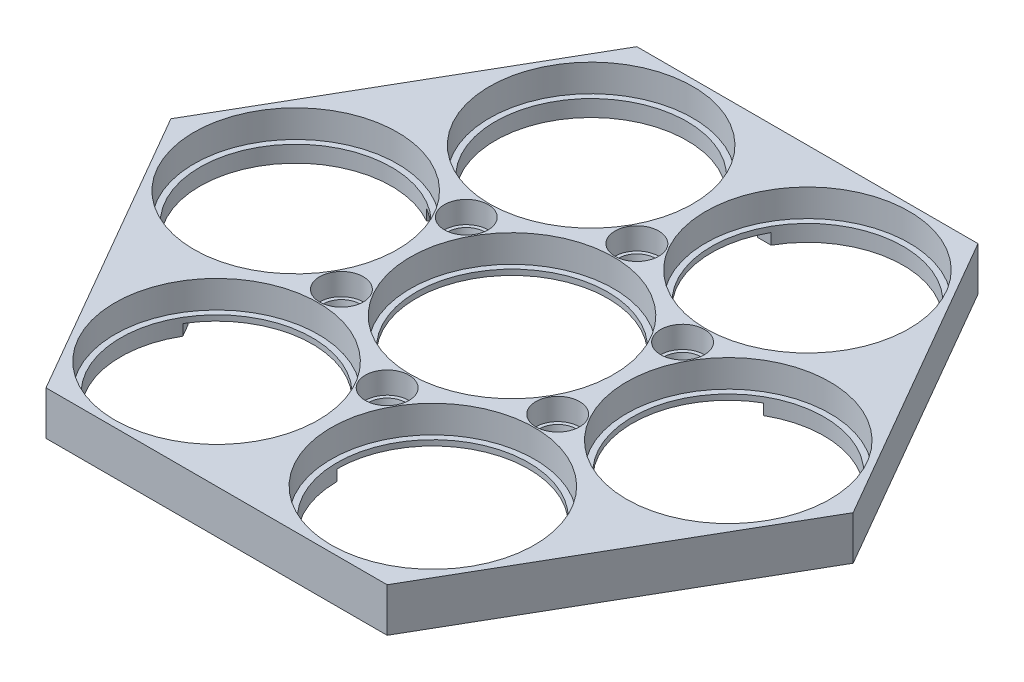
from build123d import *

# Parameters (mm, degrees)
SKETCH1_R                    = 17.5
BOSS_EXTRUDE1_DEPTH          = 1
SKETCH2_R                    = 18.575
BOSS_EXTRUDE2_DEPTH          = 5
CUT_EXTRUDE1_DEPTH           = 83.640310894
CUT_EXTRUDE1_DEPTH_BACK      = 4
SKETCH3_R                    = 4
SKETCH3_2_R                  = 4
CUT_EXTRUDE2_DEPTH           = 83.640310894
CUT_EXTRUDE2_DRAFT           = -9
CUT_EXTRUDE2_PROFILE_2_DEPTH = 83.640310894
CUT_EXTRUDE2_PROFILE_2_DRAFT = -9
CUT_EXTRUDE2_PROFILE_3_DEPTH = 83.640310894
CUT_EXTRUDE2_PROFILE_3_DRAFT = -9
CUT_EXTRUDE2_PROFILE_4_DEPTH = 83.640310894
CUT_EXTRUDE2_PROFILE_4_DRAFT = -9
CUT_EXTRUDE2_PROFILE_5_DEPTH = 83.640310894
CUT_EXTRUDE2_PROFILE_5_DRAFT = -9
CUT_EXTRUDE2_PROFILE_6_DEPTH = 83.640310894
CUT_EXTRUDE2_PROFILE_6_DRAFT = -9
BOSS_EXTRUDE3_START          = 2
BOSS_EXTRUDE3_DEPTH          = 2
CUT_EXTRUDE5_DEPTH           = 2


with BuildPart() as part:
    # Sketch1 → Boss-Extrude1 (new body)
    with BuildSketch(Plane(origin=(0, 0, 0), x_dir=(1, 0, 0), z_dir=(0, 1, 0))):
        Polygon((-31.152667816, -53.958003449), (31.152667816, -53.958003449), (62.305335633, 0), (31.152667816, 53.958003449), (-31.152667816, 53.958003449), (-62.305335633, 0), align=None)
        with Locations(Location((-39.5, 0, 0), (0, 0, 270))):
            Circle(SKETCH1_R, mode=Mode.SUBTRACT)
        with Locations(Location((-19.75, -34.208003449, 0), (0, 0, 270))):
            Circle(SKETCH1_R, mode=Mode.SUBTRACT)
        with Locations(Location((19.75, -34.208003449, 0), (0, 0, 270))):
            Circle(SKETCH1_R, mode=Mode.SUBTRACT)
        with Locations(Location((39.5, 0, 0), (0, 0, 270))):
            Circle(SKETCH1_R, mode=Mode.SUBTRACT)
        with Locations(Location((19.75, 34.208003449, 0), (0, 0, 270))):
            Circle(SKETCH1_R, mode=Mode.SUBTRACT)
        with Locations(Location((-19.75, 34.208003449, 0), (0, 0, 270))):
            Circle(SKETCH1_R, mode=Mode.SUBTRACT)
        with Locations(Location((0, 0, 0), (0, 0, 270))):
            Circle(SKETCH1_R, mode=Mode.SUBTRACT)
    extrude(amount=BOSS_EXTRUDE1_DEPTH)

    # Sketch2 → Boss-Extrude2 (add)
    with BuildSketch(Plane(origin=(0, 1, 0), x_dir=(1, 0, 0), z_dir=(0, 1, 0))):
        Polygon((62.305335633, 0), (31.152667816, 53.958003449), (-31.152667816, 53.958003449), (-62.305335633, 0), (-31.152667816, -53.958003449), (31.152667816, -53.958003449), align=None)
        with Locations(Location((-39.5, 0, 0), (0, 0, 270))):
            Circle(SKETCH2_R, mode=Mode.SUBTRACT)
        with Locations(Location((-19.75, 34.208003449, 0), (0, 0, 270))):
            Circle(SKETCH2_R, mode=Mode.SUBTRACT)
        with Locations(Location((19.75, 34.208003449, 0), (0, 0, 270))):
            Circle(SKETCH2_R, mode=Mode.SUBTRACT)
        with Locations(Location((0, 0, 0), (0, 0, 270))):
            Circle(SKETCH2_R, mode=Mode.SUBTRACT)
        with Locations(Location((39.5, 0, 0), (0, 0, 270))):
            Circle(SKETCH2_R, mode=Mode.SUBTRACT)
        with Locations(Location((19.75, -34.208003449, 0), (0, 0, 270))):
            Circle(SKETCH2_R, mode=Mode.SUBTRACT)
        with Locations(Location((-19.75, -34.208003449, 0), (0, 0, 270))):
            Circle(SKETCH2_R, mode=Mode.SUBTRACT)
    extrude(amount=BOSS_EXTRUDE2_DEPTH)

    # Sketch3 → Cut-Extrude1 (cut, two sides: drawn at the far end of the back side and taken through both)
    with BuildSketch(Plane(origin=(0, 6, 0), x_dir=(1, 0, 0), z_dir=(0, 1, 0)).offset(-CUT_EXTRUDE1_DEPTH_BACK)):
        with Locations(Location((-19.75, 11.402667816, 0), (0, 0, 90))):
            Circle(SKETCH3_R)
        with Locations(Location((19.75, 11.402667816, 0), (0, 0, 90))):
            Circle(SKETCH3_R)
        with Locations(Location((0, -22.805335633, 0), (0, 0, 90))):
            Circle(SKETCH3_R)
        with Locations(Location((-19.75, -11.402667816, 0), (0, 0, 90))):
            Circle(SKETCH3_R)
        with Locations(Location((19.75, -11.402667816, 0), (0, 0, 90))):
            Circle(SKETCH3_R)
        with Locations(Location((0, 22.805335633, 0), (0, 0, 90))):
            Circle(SKETCH3_R)
    extrude(amount=CUT_EXTRUDE1_DEPTH + CUT_EXTRUDE1_DEPTH_BACK, mode=Mode.SUBTRACT)


with BuildPart() as cut_extrude2_tool:
    # Sketch3<2> → Cut-Extrude2 (with draft: the straight prism first)
    with BuildSketch(Plane(origin=(0, 6, 0), x_dir=(1, 0, 0), z_dir=(0, 1, 0))):
        with Locations(Location((-19.75, 11.402667816, 0), (0, 0, 90))):
            Circle(SKETCH3_2_R)
    extrude(amount=-CUT_EXTRUDE2_DEPTH)
    # Cut-Extrude2: the draft: its side faces are tilted about the plane it starts from
    cut_extrude2_sides = [cut_extrude2_tool.faces().sort_by_distance(p)[0] for p in [
        (-19.75, -35.820155447, -7.402667816),
    ]]
    draft(cut_extrude2_sides, Plane(origin=(0, 6, 0), x_dir=(1, 0, 0), z_dir=(0, 1, 0)), CUT_EXTRUDE2_DRAFT)


with BuildPart() as part_1:
    add(part.part)

    # Cut-Extrude2: cut by cut_extrude2_tool
    add(cut_extrude2_tool.part, mode=Mode.SUBTRACT)


with BuildPart() as cut_extrude2_profile_2_tool:
    # Sketch3<2> → Cut-Extrude2 profile 2 (with draft: the straight prism first)
    with BuildSketch(Plane(origin=(0, 6, 0), x_dir=(1, 0, 0), z_dir=(0, 1, 0))):
        with Locations(Location((19.75, 11.402667816, 0), (0, 0, 90))):
            Circle(SKETCH3_2_R)
    extrude(amount=-CUT_EXTRUDE2_PROFILE_2_DEPTH)
    # Cut-Extrude2 profile 2: the draft: its side faces are tilted about the plane it starts from
    cut_extrude2_profile_2_sides = [cut_extrude2_profile_2_tool.faces().sort_by_distance(p)[0] for p in [
        (19.75, -35.820155447, -7.402667816),
    ]]
    draft(cut_extrude2_profile_2_sides, Plane(origin=(0, 6, 0), x_dir=(1, 0, 0), z_dir=(0, 1, 0)), CUT_EXTRUDE2_PROFILE_2_DRAFT)


with BuildPart() as part_2:
    add(part_1.part)

    # Cut-Extrude2 profile 2: cut by cut_extrude2_profile_2_tool
    add(cut_extrude2_profile_2_tool.part, mode=Mode.SUBTRACT)


with BuildPart() as cut_extrude2_profile_3_tool:
    # Sketch3<2> → Cut-Extrude2 profile 3 (with draft: the straight prism first)
    with BuildSketch(Plane(origin=(0, 6, 0), x_dir=(1, 0, 0), z_dir=(0, 1, 0))):
        with Locations(Location((0, -22.805335633, 0), (0, 0, 90))):
            Circle(SKETCH3_2_R)
    extrude(amount=-CUT_EXTRUDE2_PROFILE_3_DEPTH)
    # Cut-Extrude2 profile 3: the draft: its side faces are tilted about the plane it starts from
    cut_extrude2_profile_3_sides = [cut_extrude2_profile_3_tool.faces().sort_by_distance(p)[0] for p in [
        (0, -35.820155447, 26.805335633),
    ]]
    draft(cut_extrude2_profile_3_sides, Plane(origin=(0, 6, 0), x_dir=(1, 0, 0), z_dir=(0, 1, 0)), CUT_EXTRUDE2_PROFILE_3_DRAFT)


with BuildPart() as part_3:
    add(part_2.part)

    # Cut-Extrude2 profile 3: cut by cut_extrude2_profile_3_tool
    add(cut_extrude2_profile_3_tool.part, mode=Mode.SUBTRACT)


with BuildPart() as cut_extrude2_profile_4_tool:
    # Sketch3<2> → Cut-Extrude2 profile 4 (with draft: the straight prism first)
    with BuildSketch(Plane(origin=(0, 6, 0), x_dir=(1, 0, 0), z_dir=(0, 1, 0))):
        with Locations(Location((-19.75, -11.402667816, 0), (0, 0, 90))):
            Circle(SKETCH3_2_R)
    extrude(amount=-CUT_EXTRUDE2_PROFILE_4_DEPTH)
    # Cut-Extrude2 profile 4: the draft: its side faces are tilted about the plane it starts from
    cut_extrude2_profile_4_sides = [cut_extrude2_profile_4_tool.faces().sort_by_distance(p)[0] for p in [
        (-19.75, -35.820155447, 15.402667816),
    ]]
    draft(cut_extrude2_profile_4_sides, Plane(origin=(0, 6, 0), x_dir=(1, 0, 0), z_dir=(0, 1, 0)), CUT_EXTRUDE2_PROFILE_4_DRAFT)


with BuildPart() as part_4:
    add(part_3.part)

    # Cut-Extrude2 profile 4: cut by cut_extrude2_profile_4_tool
    add(cut_extrude2_profile_4_tool.part, mode=Mode.SUBTRACT)


with BuildPart() as cut_extrude2_profile_5_tool:
    # Sketch3<2> → Cut-Extrude2 profile 5 (with draft: the straight prism first)
    with BuildSketch(Plane(origin=(0, 6, 0), x_dir=(1, 0, 0), z_dir=(0, 1, 0))):
        with Locations(Location((19.75, -11.402667816, 0), (0, 0, 90))):
            Circle(SKETCH3_2_R)
    extrude(amount=-CUT_EXTRUDE2_PROFILE_5_DEPTH)
    # Cut-Extrude2 profile 5: the draft: its side faces are tilted about the plane it starts from
    cut_extrude2_profile_5_sides = [cut_extrude2_profile_5_tool.faces().sort_by_distance(p)[0] for p in [
        (19.75, -35.820155447, 15.402667816),
    ]]
    draft(cut_extrude2_profile_5_sides, Plane(origin=(0, 6, 0), x_dir=(1, 0, 0), z_dir=(0, 1, 0)), CUT_EXTRUDE2_PROFILE_5_DRAFT)


with BuildPart() as part_5:
    add(part_4.part)

    # Cut-Extrude2 profile 5: cut by cut_extrude2_profile_5_tool
    add(cut_extrude2_profile_5_tool.part, mode=Mode.SUBTRACT)


with BuildPart() as cut_extrude2_profile_6_tool:
    # Sketch3<2> → Cut-Extrude2 profile 6 (with draft: the straight prism first)
    with BuildSketch(Plane(origin=(0, 6, 0), x_dir=(1, 0, 0), z_dir=(0, 1, 0))):
        with Locations(Location((0, 22.805335633, 0), (0, 0, 90))):
            Circle(SKETCH3_2_R)
    extrude(amount=-CUT_EXTRUDE2_PROFILE_6_DEPTH)
    # Cut-Extrude2 profile 6: the draft: its side faces are tilted about the plane it starts from
    cut_extrude2_profile_6_sides = [cut_extrude2_profile_6_tool.faces().sort_by_distance(p)[0] for p in [
        (0, -35.820155447, -18.805335633),
    ]]
    draft(cut_extrude2_profile_6_sides, Plane(origin=(0, 6, 0), x_dir=(1, 0, 0), z_dir=(0, 1, 0)), CUT_EXTRUDE2_PROFILE_6_DRAFT)


with BuildPart() as part_6:
    add(part_5.part)

    # Cut-Extrude2 profile 6: cut by cut_extrude2_profile_6_tool
    add(cut_extrude2_profile_6_tool.part, mode=Mode.SUBTRACT)

    # Sketch5 → Boss-Extrude3 (add)
    with BuildSketch(Plane.XZ.offset(BOSS_EXTRUDE3_START)):
        with BuildLine():
            Line((-31.152667816, 53.958003449), (-62.305335633, 0))
            Line((-62.305335633, 0), (-57, 0))
            ThreePointArc((-57, 0), (-51.812065653, 12.43635957), (-39.324224074, 17.499117201))
            Line((-39.324224074, 17.499117201), (-34.816792077, 25.306218432))
            ThreePointArc((-34.816792077, 25.306218432), (-24.364170491, 51.088744863), (-2.25, 34.208003449))
            Line((-2.25, 34.208003449), (2.25, 34.208003449))
            ThreePointArc((2.25, 34.208003449), (11, 49.363448016), (28.5, 49.363448016))
            Line((28.5, 49.363448016), (31.152667816, 53.958003449))
            Line((31.152667816, 53.958003449), (-31.152667816, 53.958003449))
        make_face()
        with BuildLine():
            Line((-57, 0), (-62.305335633, 0))
            Line((-62.305335633, 0), (-31.152667816, -53.958003449))
            Line((-31.152667816, -53.958003449), (31.152667816, -53.958003449))
            Line((31.152667816, -53.958003449), (28.5, -49.363448016))
            ThreePointArc((28.5, -49.363448016), (15.135829509, -51.088744863), (4.507431997, -42.805335633))
            Line((4.507431997, -42.805335633), (-4.507431997, -42.805335633))
            ThreePointArc((-4.507431997, -42.805335633), (-32.062065653, -46.644363019), (-28.5, -19.052558883))
            Line((-28.5, -19.052558883), (-30.75, -15.155444566))
            ThreePointArc((-30.75, -15.155444566), (-48.25, -15.155444566), (-57, 0))
        make_face()
        with BuildLine():
            Line((28.5, -49.363448016), (31.152667816, -53.958003449))
            Line((31.152667816, -53.958003449), (62.305335633, 0))
            Line((62.305335633, 0), (31.152667816, 53.958003449))
            Line((31.152667816, 53.958003449), (28.5, 49.363448016))
            ThreePointArc((28.5, 49.363448016), (34.905444566, 42.958003449), (37.25, 34.208003449))
            ThreePointArc((37.25, 34.208003449), (36.630741414, 29.593832958), (34.816792077, 25.306218432))
            Line((34.816792077, 25.306218432), (39.324224074, 17.499117201))
            ThreePointArc((39.324224074, 17.499117201), (51.812065653, 12.43635957), (57, 0))
            ThreePointArc((57, 0), (48.25, -15.155444566), (30.75, -15.155444566))
            Line((30.75, -15.155444566), (28.5, -19.052558883))
            ThreePointArc((28.5, -19.052558883), (34.905444566, -25.458003449), (37.25, -34.208003449))
            ThreePointArc((37.25, -34.208003449), (34.905444566, -42.958003449), (28.5, -49.363448016))
        make_face()
    extrude(amount=-BOSS_EXTRUDE3_DEPTH)

    # Sketch6 → Cut-Extrude5 (cut)
    with BuildSketch(Plane.XZ.offset(2)):
        with BuildLine():
            ThreePointArc((-2, -47.537386441), (-1, -48.537386441), (0, -47.537386441))
            ThreePointArc((0, -47.537386441), (1, -48.537386441), (2, -47.537386441))
            Line((2, -47.537386441), (2, -42.805335633))
            Line((2, -42.805335633), (-2, -42.805335633))
            Line((-2, -42.805335633), (-2, -47.537386441))
        make_face()
        with BuildLine():
            ThreePointArc((-40.168584287, 25.500744028), (-41.534609686, 25.134718633), (-41.168584305, 23.76869323))
            ThreePointArc((-41.168584305, 23.76869323), (-42.534609696, 23.402667808), (-42.168584287, 22.036642413))
            Line((-42.168584287, 22.036642413), (-38.070508076, 19.670617009))
            Line((-38.070508076, 19.670617009), (-36.070508076, 23.134718624))
            Line((-36.070508076, 23.134718624), (-40.168584287, 25.500744028))
        make_face()
    extrude(amount=-CUT_EXTRUDE5_DEPTH, mode=Mode.SUBTRACT)


solid = part_6.part
